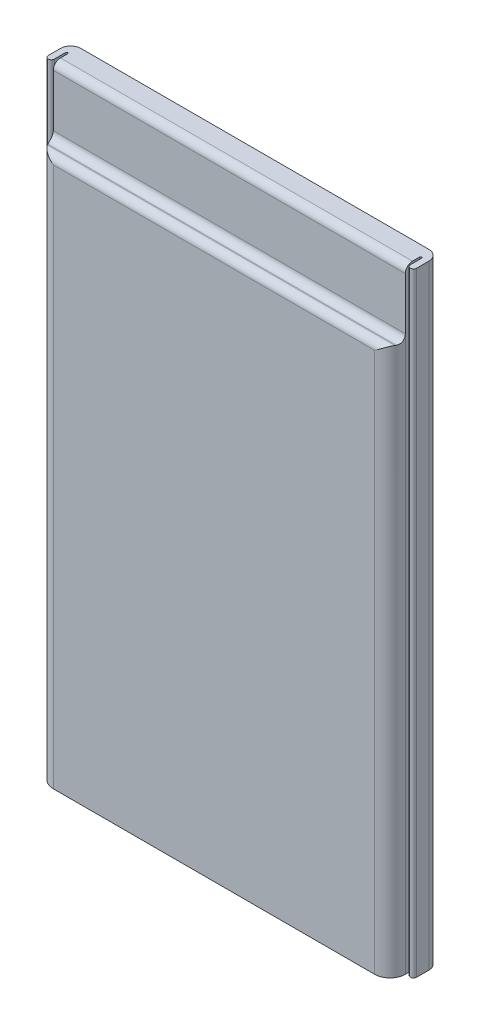
from build123d import *

# Parameters (mm, degrees)
EXTRUDE_1_DEPTH                 = 30
CUT_EXTRUDE_1_REACH             = 37.214
CUT_EXTRUDE_1_DIRECTION_2_REACH = 37.214


with BuildPart() as part:
    # Эскиз1 → Бобышка-Вытянуть1 (new, symmetric)
    with BuildSketch(Plane(origin=(0, 0, 0), x_dir=(1, 0, 0), z_dir=(0, 1, 0))):
        with BuildLine():
            Line((-17, 0), (17, 0))
            ThreePointArc((17, 0), (17.707106781, -0.292893219), (18, -1))
            Line((18, -1), (18, -2.2))
            ThreePointArc((18, -2.2), (17.7, -2.5), (17.4, -2.2))
            Line((17.4, -2.2), (17.4, -1.1))
            ThreePointArc((17.4, -1.1), (17.3, -1), (17.2, -1.1))
            Line((17.2, -1.1), (17.2, -2.5))
            ThreePointArc((17.2, -2.5), (16.760660172, -3.560660172), (15.7, -4))
            Line((15.7, -4), (-15.7, -4))
            ThreePointArc((-15.7, -4), (-16.760660172, -3.560660172), (-17.2, -2.5))
            Line((-17.2, -2.5), (-17.2, -1.1))
            ThreePointArc((-17.2, -1.1), (-17.3, -1), (-17.4, -1.1))
            Line((-17.4, -1.1), (-17.4, -2.2))
            ThreePointArc((-17.4, -2.2), (-17.7, -2.5), (-18, -2.2))
            Line((-18, -2.2), (-18, -1))
            ThreePointArc((-18, -1), (-17.707106781, -0.292893219), (-17, 0))
        make_face()
    extrude(amount=EXTRUDE_1_DEPTH, both=True)

    # Эскиз2 → Вырез-Вытянуть1 (cut, up to next)
    with BuildSketch(Plane(origin=(0, 0, 0), x_dir=(0, 0, -1), z_dir=(1, 0, 0)), mode=Mode.PRIVATE) as cut_extrude_1_sk1:
        with BuildLine():
            Line((-2.5, 29.3), (-2.5, 24.2))
            ThreePointArc((-2.5, 24.2), (-2.705025253, 23.705025253), (-3.2, 23.5))
            Line((-3.2, 23.5), (-3.3, 23.5))
            ThreePointArc((-3.3, 23.5), (-3.794974747, 23.294974747), (-4, 22.8))
            Line((-4, 22.8), (-4, 30))
            Line((-4, 30), (-1.8, 30))
            ThreePointArc((-1.8, 30), (-2.294974747, 29.794974747), (-2.5, 29.3))
        make_face()
    cut_extrude_1_tool1 = extrude(cut_extrude_1_sk1.sketch, amount=-CUT_EXTRUDE_1_REACH, mode=Mode.PRIVATE) & part.part
    add(cut_extrude_1_tool1.solids().sort_by_distance((0, 26.779673, 3.252998))[0], mode=Mode.SUBTRACT)

    # Эскиз2 → Вырез-Вытянуть1 direction 2 (cut, up to next)
    with BuildSketch(Plane(origin=(0, 0, 0), x_dir=(0, 0, -1), z_dir=(1, 0, 0)), mode=Mode.PRIVATE) as cut_extrude_1_direction_2_sk1:
        with BuildLine():
            Line((-2.5, 29.3), (-2.5, 24.2))
            ThreePointArc((-2.5, 24.2), (-2.705025253, 23.705025253), (-3.2, 23.5))
            Line((-3.2, 23.5), (-3.3, 23.5))
            ThreePointArc((-3.3, 23.5), (-3.794974747, 23.294974747), (-4, 22.8))
            Line((-4, 22.8), (-4, 30))
            Line((-4, 30), (-1.8, 30))
            ThreePointArc((-1.8, 30), (-2.294974747, 29.794974747), (-2.5, 29.3))
        make_face()
    cut_extrude_1_direction_2_tool1 = extrude(cut_extrude_1_direction_2_sk1.sketch, amount=CUT_EXTRUDE_1_DIRECTION_2_REACH, mode=Mode.PRIVATE) & part.part
    add(cut_extrude_1_direction_2_tool1.solids().sort_by_distance((0, 26.779673, 3.252998))[0], mode=Mode.SUBTRACT)


solid = part.part
